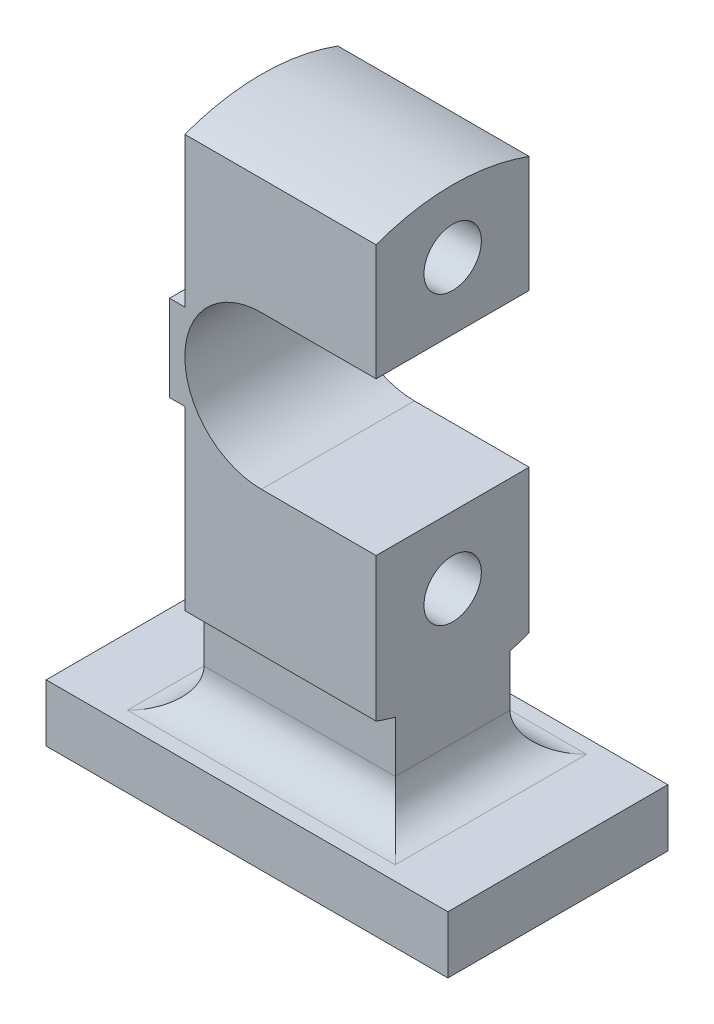
from build123d import *

# Parameters (mm, degrees)
SKETCH1_W           = 210
SKETCH1_H           = 115
BOSS_EXTRUDE2_DEPTH = 30
SKETCH6_W           = 60
SKETCH6_H           = 60
BOSS_EXTRUDE3_DEPTH = 50
SKETCH8_R           = 15
BOSS_EXTRUDE4_DEPTH = 50
FILLET1_R           = 20
BOSS_EXTRUDE5_DEPTH = 80
CUT_EXTRUDE1_DEPTH  = 336.046164359


with BuildPart() as part:
    # Sketch1 → Boss-Extrude2 (new body)
    with BuildSketch(Plane(origin=(0, 0, 0), x_dir=(1, 0, 0), z_dir=(0, 1, 0))):
        Rectangle(SKETCH1_W, SKETCH1_H)
    extrude(amount=BOSS_EXTRUDE2_DEPTH)

    # Sketch6 → Boss-Extrude3 (add, symmetric)
    with BuildSketch(Plane(origin=(0, 0, 0), x_dir=(0, 0, -1), z_dir=(1, 0, 0))):
        with Locations((0, 55.329200869)):
            Rectangle(SKETCH6_W, SKETCH6_H)
    extrude(amount=BOSS_EXTRUDE3_DEPTH, both=True)

    # Sketch8 → Boss-Extrude4 (add, symmetric)
    with BuildSketch(Plane(origin=(0, 0, 0), x_dir=(0, 0, -1), z_dir=(1, 0, 0))):
        with BuildLine():
            Line((40, 295.680123104), (40, 80.041536576))
            ThreePointArc((40, 80.041536576), (0, 72.86082984), (-40, 80.041536576))
            Line((-40, 80.041536576), (-40, 295.680123104))
            ThreePointArc((-40, 295.680123104), (0, 302.86082984), (40, 295.680123104))
        make_face()
        with Locations((0, 270)):
            Circle(SKETCH8_R, mode=Mode.SUBTRACT)
        with Locations((0, 120)):
            Circle(SKETCH8_R, mode=Mode.SUBTRACT)
    extrude(amount=BOSS_EXTRUDE4_DEPTH, both=True)

    # Fillet1
    fillet1_edges = [part.edges().sort_by_distance(p)[0] for p in [
        (-50, 30, 0),
        (0, 30, -30),
        (50, 30, 0),
        (0, 30, 30),
    ]]
    fillet(fillet1_edges, radius=FILLET1_R)

    # Sketch9 → Boss-Extrude5 (add)
    with BuildSketch(Plane(origin=(0, 0, -40), x_dir=(-1, 0, 0), z_dir=(0, 0, -1))):
        Polygon((58, 217.5), (50, 217.5), (50, 194.99999986), (50, 172.5), (58, 172.5), align=None)
    extrude(amount=-BOSS_EXTRUDE5_DEPTH)

    # Sketch9<3> → Cut-Extrude1 (cut, through all)
    with BuildSketch(Plane(origin=(0, 0, -40), x_dir=(-1, 0, 0), z_dir=(0, 0, -1))):
        with BuildLine():
            ThreePointArc((50, 194.999999634), (38.284271377, 223.284271118), (10, 235))
            Line((10, 235), (-50, 235))
            Line((-50, 235), (-50, 155))
            Line((-50, 155), (10, 155))
            ThreePointArc((10, 155), (38.284271118, 166.715728623), (50, 194.999999634))
        make_face()
    extrude(amount=-CUT_EXTRUDE1_DEPTH, mode=Mode.SUBTRACT)


solid = part.part
